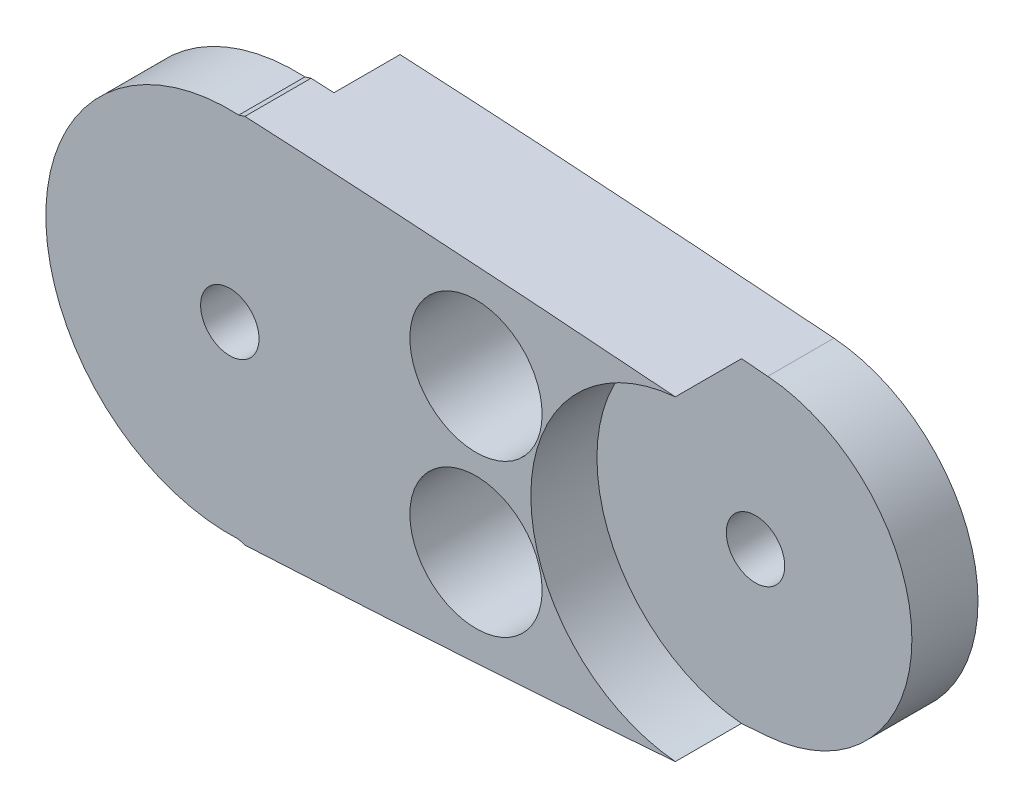
from build123d import *

# Parameters (mm, degrees)
BOSS_EXTRUDE2_DEPTH = 12
SKETCH2_R           = 14.190949605
SKETCH2_R_2         = 2.65
BOSS_EXTRUDE3_DEPTH = 6
BOSS_EXTRUDE4_START = 6
SKETCH2_24_R        = 16.896313039
SKETCH2_24_R_2      = 2.65
BOSS_EXTRUDE4_DEPTH = 6
CUT_EXTRUDE3_DEPTH  = 189.258998684
CUT_EXTRUDE5_DEPTH  = 189.258998684
CUT_EXTRUDE6_START  = -10
CUT_EXTRUDE6_DEPTH  = 10
SKETCH7_R           = 6
CUT_EXTRUDE7_DEPTH  = 189.54140377


with BuildPart() as part:
    # Sketch2<21> → Boss-Extrude2 (new body)
    with BuildSketch(Plane.XY):
        with BuildLine():
            add(Edge.make_bspline(
                [(174.328689217, 14.146966087), (174.040831823, 14.169682671), (169.855389857, 14.498930953), (161.747864996, 15.106955372), (150.003172521, 15.898554075), (140.188386584, 16.476242113), (134.2963802, 16.779872269), (132.328689217, 16.8761315)],
                knots=[0.206706183, 0.206706183, 0.206706183, 0.206706183, 0.208122338, 0.227296649, 0.24658007, 0.265853108, 0.275514954, 0.275514954, 0.275514954, 0.275514954], degree=3))
            ThreePointArc((132.328689217, 16.8761315), (148.39942372, 0), (132.328689217, -16.8761315))
            add(Edge.make_bspline(
                [(132.328689217, -16.8761315), (134.2963802, -16.779872269), (140.188386584, -16.476242113), (150.003172521, -15.898554075), (161.747864996, -15.106955372), (169.855389857, -14.498930953), (174.040831823, -14.169682671), (174.328689217, -14.146966087)],
                knots=[0.724485046, 0.724485046, 0.724485046, 0.724485046, 0.734146892, 0.75341993, 0.772703351, 0.791877662, 0.793293817, 0.793293817, 0.793293817, 0.793293817], degree=3))
            ThreePointArc((174.328689217, -14.146966087), (159.021316208, 0), (174.328689217, 14.146966087))
        make_face()
    extrude(amount=BOSS_EXTRUDE2_DEPTH)

    # Sketch2 → Boss-Extrude3 (add)
    with BuildSketch(Plane.XY):
        with Locations((173.212265813, 0)):
            Circle(SKETCH2_R)
        with Locations((173.212265813, 0)):
            Circle(SKETCH2_R_2, mode=Mode.SUBTRACT)
    extrude(amount=BOSS_EXTRUDE3_DEPTH)

    # Sketch2<24> → Boss-Extrude4 (add)
    with BuildSketch(Plane.XY.offset(BOSS_EXTRUDE4_START)):
        with Locations((131.503110681, 0)):
            Circle(SKETCH2_24_R)
        with Locations((131.503110681, 0)):
            Circle(SKETCH2_24_R_2, mode=Mode.SUBTRACT)
    extrude(amount=BOSS_EXTRUDE4_DEPTH)

    # Sketch4 → Cut-Extrude3 (cut, through all)
    with BuildSketch(Plane.XY.offset(6)):
        with BuildLine():
            add(Edge.make_bspline(
                [(174.328689217, 14.146966087), (173.530907872, 14.209923879), (172.733082923, 14.272330644), (171.935214304, 14.334174897)],
                knots=[0.206706183, 0.206706183, 0.206706183, 0.206706183, 0.210630981, 0.210630981, 0.210630981, 0.210630981], degree=3))
            ThreePointArc((171.935214304, 14.334174897), (158.821316208, -4e-08), (171.935214382, -14.334174904))
            add(Edge.make_bspline(
                [(171.935214382, -14.334174904), (172.733082975, -14.272330648), (173.530907898, -14.209923882), (174.328689217, -14.146966087)],
                knots=[0.789369019, 0.789369019, 0.789369019, 0.789369019, 0.793293817, 0.793293817, 0.793293817, 0.793293817], degree=3))
            ThreePointArc((174.328689217, -14.146966087), (159.021316208, 0), (174.328689217, 14.146966087))
        make_face()
    extrude(amount=CUT_EXTRUDE3_DEPTH, mode=Mode.SUBTRACT)

    # Sketch5 → Cut-Extrude5 (cut, through all)
    with BuildSketch(Plane(origin=(0, 0, 6), x_dir=(-1, 0, 0), z_dir=(0, 0, -1))):
        with BuildLine():
            ThreePointArc((-132.328689217, -16.8761315), (-148.39942372, 0), (-132.328689217, 16.8761315))
            add(Edge.make_bspline(
                [(-134.952258251, 16.74476935), (-134.077785352, 16.789550444), (-133.203262036, 16.833347492), (-132.328689217, 16.8761315)],
                knots=[0.271220587, 0.271220587, 0.271220587, 0.271220587, 0.275514954, 0.275514954, 0.275514954, 0.275514954], degree=3))
            ThreePointArc((-134.952258251, 16.74476935), (-148.59942372, 0), (-134.952258251, -16.74476935))
            add(Edge.make_bspline(
                [(-132.328689217, -16.8761315), (-133.203262036, -16.833347492), (-134.077785352, -16.789550444), (-134.952258251, -16.74476935)],
                knots=[0.724485046, 0.724485046, 0.724485046, 0.724485046, 0.728779413, 0.728779413, 0.728779413, 0.728779413], degree=3))
        make_face()
    extrude(amount=CUT_EXTRUDE5_DEPTH, mode=Mode.SUBTRACT)

    # Sketch6 → Cut-Extrude6 (cut)
    with BuildSketch(Plane.XY.offset(12).offset(CUT_EXTRUDE6_START)):
        with BuildLine():
            ThreePointArc((132.318916925, -16.676370387), (114.806797716, 0.001573603), (132.322060358, 16.676216313))
            Line((132.322060358, 16.676216313), (132.876380652, 16.849206008))
            add(Edge.make_bspline(
                [(132.876380652, 16.849206008), (132.693819003, 16.85822514), (132.511255189, 16.867200392), (132.328689217, 16.8761315)],
                knots=[0.27461851, 0.27461851, 0.27461851, 0.27461851, 0.275514954, 0.275514954, 0.275514954, 0.275514954], degree=3))
            ThreePointArc((132.328689217, 16.8761315), (114.606797642, 0), (132.328689217, -16.8761315))
            add(Edge.make_bspline(
                [(132.328689217, -16.8761315), (132.511255189, -16.867200392), (132.693819003, -16.85822514), (132.876380652, -16.849206008)],
                knots=[0.724485046, 0.724485046, 0.724485046, 0.724485046, 0.72538149, 0.72538149, 0.72538149, 0.72538149], degree=3))
            Line((132.876380652, -16.849206008), (132.318916925, -16.676370387))
        make_face()
    extrude(amount=CUT_EXTRUDE6_DEPTH, mode=Mode.SUBTRACT)

    # Sketch7 → Cut-Extrude7 (cut, through all)
    with BuildSketch(Plane.XY.offset(12)):
        with Locations((153.843979232, 6.920740335)):
            Circle(SKETCH7_R)
        with Locations((153.843979232, -6.917593129)):
            Circle(SKETCH7_R)
    extrude(amount=-CUT_EXTRUDE7_DEPTH, mode=Mode.SUBTRACT)


solid = part.part
